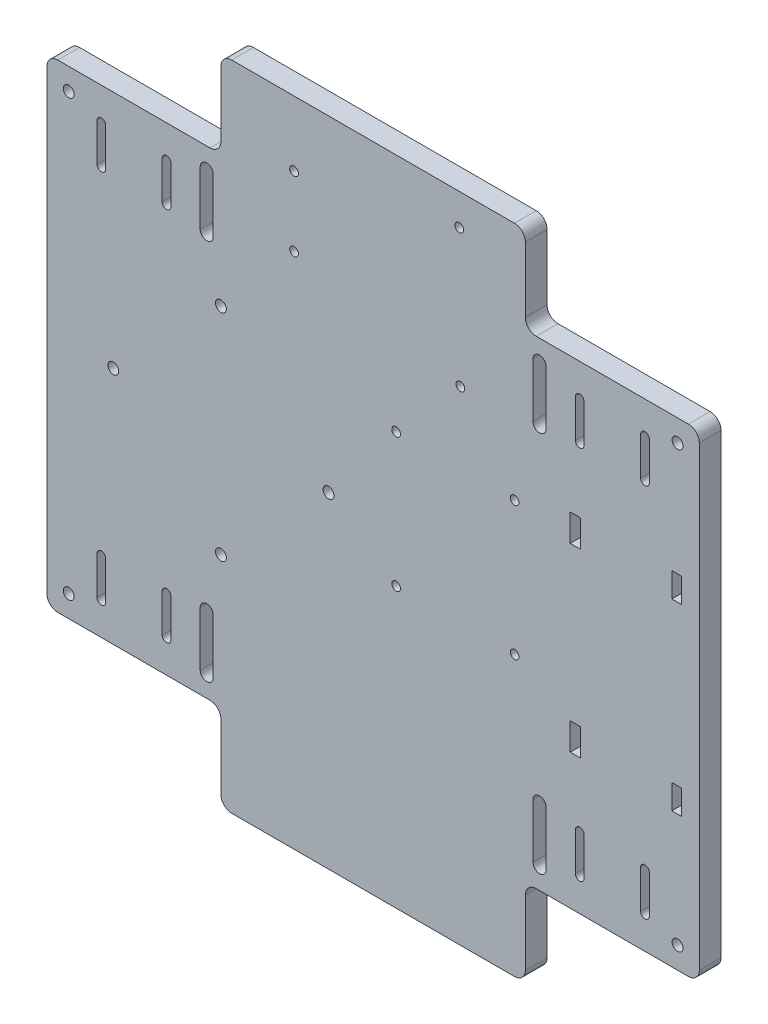
from build123d import *

# Parameters (mm, degrees)
SKETCH_1_R      = 2.5
SKETCH_1_R_2    = 2
SKETCH_1_W      = 4.718060626
SKETCH_1_H      = 12.511006694
SKETCH_1_W_2    = 4.554527511
SKETCH_1_H_2    = 11.281053154
SKETCH_1_H_3    = 12.511006695
SKETCH_1_H_4    = 11.281053155
EXTRUDE_1_DEPTH = 10


with BuildPart() as part:
    # 草图1 → 凸台-拉伸1 (new body)
    with BuildSketch(Plane.XY):
        with BuildLine():
            ThreePointArc((79.970680431, 2.987579423), (81.435146525, -0.547954483), (84.970680431, -2.012420577))
            Line((84.970680431, -2.012420577), (214.970680431, -2.012420577))
            ThreePointArc((214.970680431, -2.012420577), (218.506214337, -0.547954483), (219.970680431, 2.987579423))
            Line((219.970680431, 2.987579423), (219.970680431, 32.987579423))
            ThreePointArc((219.970680431, 32.987579423), (221.435146525, 36.523113329), (224.970680431, 37.987579423))
            Line((224.970680431, 37.987579423), (294.970680431, 37.987579423))
            ThreePointArc((294.970680431, 37.987579423), (298.506214337, 39.452045517), (299.970680431, 42.987579423))
            Line((299.970680431, 42.987579423), (299.970680431, 252.987579423))
            ThreePointArc((299.970680431, 252.987579423), (298.506214337, 256.523113329), (294.970680431, 257.987579423))
            Line((294.970680431, 257.987579423), (224.970680431, 257.987579423))
            ThreePointArc((224.970680431, 257.987579423), (221.435146525, 259.452045517), (219.970680431, 262.987579423))
            Line((219.970680431, 262.987579423), (219.970680431, 292.987579423))
            ThreePointArc((219.970680431, 292.987579423), (218.506214337, 296.523113329), (214.970680431, 297.987579423))
            Line((214.970680431, 297.987579423), (84.970680431, 297.987579423))
            ThreePointArc((84.970680431, 297.987579423), (81.435146525, 296.523113329), (79.970680431, 292.987579423))
            Line((79.970680431, 292.987579423), (79.970680431, 262.987579423))
            ThreePointArc((79.970680431, 262.987579423), (78.506214337, 259.452045517), (74.970680431, 257.987579423))
            Line((74.970680431, 257.987579423), (4.970680431, 257.987579423))
            ThreePointArc((4.970680431, 257.987579423), (1.435146525, 256.523113329), (-0.029319569, 252.987579423))
            Line((-0.029319569, 252.987579423), (-0.029319569, 42.987579423))
            ThreePointArc((-0.029319569, 42.987579423), (1.435146525, 39.452045517), (4.970680431, 37.987579423))
            Line((4.970680431, 37.987579423), (74.970680431, 37.987579423))
            ThreePointArc((74.970680431, 37.987579423), (78.506214337, 36.523113329), (79.970680431, 32.987579423))
            Line((79.970680431, 32.987579423), (79.970680431, 2.987579423))
        make_face()
        with Locations((9.970680431, 47.987579423)):
            Circle(SKETCH_1_R, mode=Mode.SUBTRACT)
        with BuildLine():
            ThreePointArc((22.970680431, 70.487579423), (24.970680431, 72.487579423), (26.970680431, 70.487579423))
            Line((26.970680431, 70.487579423), (26.970680431, 52.987579423))
            ThreePointArc((26.970680431, 52.987579423), (24.970680431, 50.987579423), (22.970680431, 52.987579423))
            Line((22.970680431, 52.987579423), (22.970680431, 70.487579423))
        make_face(mode=Mode.SUBTRACT)
        with BuildLine():
            ThreePointArc((52.970680431, 70.487579423), (54.970680431, 72.487579423), (56.970680431, 70.487579423))
            Line((56.970680431, 70.487579423), (56.970680431, 52.987579423))
            ThreePointArc((56.970680431, 52.987579423), (54.970680431, 50.987579423), (52.970680431, 52.987579423))
            Line((52.970680431, 52.987579423), (52.970680431, 70.487579423))
        make_face(mode=Mode.SUBTRACT)
        with BuildLine():
            ThreePointArc((76.446824756, 47.714083435), (73.446824756, 44.714083435), (70.446824756, 47.714083435))
            Line((70.446824756, 47.714083435), (70.446824756, 72.714083435))
            ThreePointArc((70.446824756, 72.714083435), (73.446824756, 75.714083435), (76.446824756, 72.714083435))
            Line((76.446824756, 72.714083435), (76.446824756, 47.714083435))
        make_face(mode=Mode.SUBTRACT)
        with Locations((30.470680431, 147.987579423)):
            Circle(SKETCH_1_R, mode=Mode.SUBTRACT)
        with Locations((79.970680431, 98.487579423)):
            Circle(SKETCH_1_R, mode=Mode.SUBTRACT)
        with Locations((129.470680431, 147.987579423)):
            Circle(SKETCH_1_R, mode=Mode.SUBTRACT)
        with BuildLine():
            Line((229.494536105, 72.714083435), (229.494536105, 47.714083435))
            ThreePointArc((229.494536105, 47.714083435), (226.494536105, 44.714083435), (223.494536105, 47.714083435))
            Line((223.494536105, 47.714083435), (223.494536105, 72.714083435))
            ThreePointArc((223.494536105, 72.714083435), (226.494536105, 75.714083435), (229.494536105, 72.714083435))
        make_face(mode=Mode.SUBTRACT)
        with BuildLine():
            ThreePointArc((242.970680431, 70.487579423), (244.970680431, 72.487579423), (246.970680431, 70.487579423))
            Line((246.970680431, 70.487579423), (246.970680431, 52.987579423))
            ThreePointArc((246.970680431, 52.987579423), (244.970680431, 50.987579423), (242.970680431, 52.987579423))
            Line((242.970680431, 52.987579423), (242.970680431, 70.487579423))
        make_face(mode=Mode.SUBTRACT)
        with Locations((289.970680431, 47.987579423)):
            Circle(SKETCH_1_R, mode=Mode.SUBTRACT)
        with BuildLine():
            ThreePointArc((276.970680431, 52.987579423), (274.970680431, 50.987579423), (272.970680431, 52.987579423))
            Line((272.970680431, 52.987579423), (272.970680431, 70.487579423))
            ThreePointArc((272.970680431, 70.487579423), (274.970680431, 72.487579423), (276.970680431, 70.487579423))
            Line((276.970680431, 70.487579423), (276.970680431, 52.987579423))
        make_face(mode=Mode.SUBTRACT)
        with Locations((160.553347356, 126.301390813)):
            Circle(SKETCH_1_R_2, mode=Mode.SUBTRACT)
        with Locations((215.033347356, 126.301390813)):
            Circle(SKETCH_1_R_2, mode=Mode.SUBTRACT)
        with Locations((242.957198236, 106.410275276)):
            Rectangle(SKETCH_1_W, SKETCH_1_H, mode=Mode.SUBTRACT)
        with Locations((289.593492305, 105.795298506)):
            Rectangle(SKETCH_1_W_2, SKETCH_1_H_2, mode=Mode.SUBTRACT)
        with Locations((79.970680431, 197.487579423)):
            Circle(SKETCH_1_R, mode=Mode.SUBTRACT)
        with BuildLine():
            Line((26.970680431, 242.987579423), (26.970680431, 225.487579423))
            ThreePointArc((26.970680431, 225.487579423), (24.970680431, 223.487579423), (22.970680431, 225.487579423))
            Line((22.970680431, 225.487579423), (22.970680431, 242.987579423))
            ThreePointArc((22.970680431, 242.987579423), (24.970680431, 244.987579423), (26.970680431, 242.987579423))
        make_face(mode=Mode.SUBTRACT)
        with Locations((9.970680431, 247.987579423)):
            Circle(SKETCH_1_R, mode=Mode.SUBTRACT)
        with BuildLine():
            Line((56.970680431, 242.987579423), (56.970680431, 225.487579423))
            ThreePointArc((56.970680431, 225.487579423), (54.970680431, 223.487579423), (52.970680431, 225.487579423))
            Line((52.970680431, 225.487579423), (52.970680431, 242.987579423))
            ThreePointArc((52.970680431, 242.987579423), (54.970680431, 244.987579423), (56.970680431, 242.987579423))
        make_face(mode=Mode.SUBTRACT)
        with BuildLine():
            Line((70.446824756, 223.261075411), (70.446824756, 248.261075411))
            ThreePointArc((70.446824756, 248.261075411), (73.446824756, 251.261075411), (76.446824756, 248.261075411))
            Line((76.446824756, 248.261075411), (76.446824756, 223.261075411))
            ThreePointArc((76.446824756, 223.261075411), (73.446824756, 220.261075411), (70.446824756, 223.261075411))
        make_face(mode=Mode.SUBTRACT)
        with Locations((113.606281629, 236.082638095)):
            Circle(SKETCH_1_R_2, mode=Mode.SUBTRACT)
        with Locations((113.606281629, 268.082638095)):
            Circle(SKETCH_1_R_2, mode=Mode.SUBTRACT)
        with Locations((160.553347356, 187.721390813)):
            Circle(SKETCH_1_R_2, mode=Mode.SUBTRACT)
        with Locations((215.033347356, 187.721390813)):
            Circle(SKETCH_1_R_2, mode=Mode.SUBTRACT)
        with Locations((190.106281629, 220.582638095)):
            Circle(SKETCH_1_R_2, mode=Mode.SUBTRACT)
        with Locations((242.957198236, 189.56488357)):
            Rectangle(SKETCH_1_W, SKETCH_1_H_3, mode=Mode.SUBTRACT)
        with Locations((289.593492305, 190.17986034)):
            Rectangle(SKETCH_1_W_2, SKETCH_1_H_4, mode=Mode.SUBTRACT)
        with Locations((189.606281629, 283.582638095)):
            Circle(SKETCH_1_R_2, mode=Mode.SUBTRACT)
        with BuildLine():
            ThreePointArc((223.494536105, 248.261075411), (226.494536105, 251.261075411), (229.494536105, 248.261075411))
            Line((229.494536105, 248.261075411), (229.494536105, 223.261075411))
            ThreePointArc((229.494536105, 223.261075411), (226.494536105, 220.261075411), (223.494536105, 223.261075411))
            Line((223.494536105, 223.261075411), (223.494536105, 248.261075411))
        make_face(mode=Mode.SUBTRACT)
        with BuildLine():
            Line((246.970680431, 242.987579423), (246.970680431, 225.487579423))
            ThreePointArc((246.970680431, 225.487579423), (244.970680431, 223.487579423), (242.970680431, 225.487579423))
            Line((242.970680431, 225.487579423), (242.970680431, 242.987579423))
            ThreePointArc((242.970680431, 242.987579423), (244.970680431, 244.987579423), (246.970680431, 242.987579423))
        make_face(mode=Mode.SUBTRACT)
        with BuildLine():
            Line((272.970680431, 225.487579423), (272.970680431, 242.987579423))
            ThreePointArc((272.970680431, 242.987579423), (274.970680431, 244.987579423), (276.970680431, 242.987579423))
            Line((276.970680431, 242.987579423), (276.970680431, 225.487579423))
            ThreePointArc((276.970680431, 225.487579423), (274.970680431, 223.487579423), (272.970680431, 225.487579423))
        make_face(mode=Mode.SUBTRACT)
        with Locations((289.970680431, 247.987579423)):
            Circle(SKETCH_1_R, mode=Mode.SUBTRACT)
    extrude(amount=EXTRUDE_1_DEPTH)


solid = part.part
